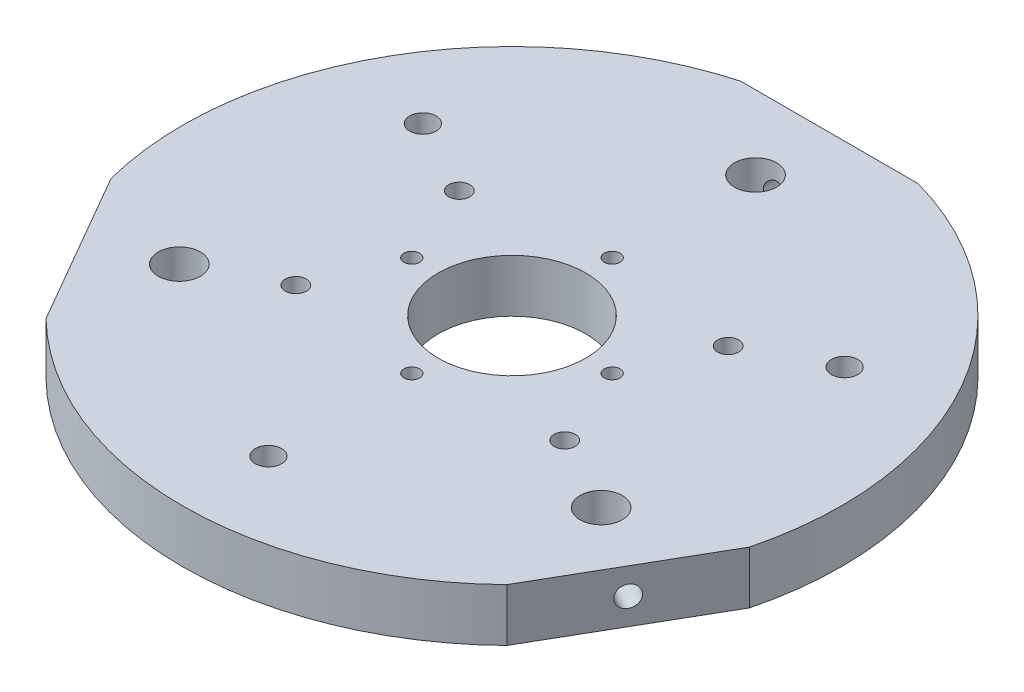
from build123d import *

# Parameters (mm, degrees)
SKETCH1_R           = 62.5
SKETCH1_R_2         = 4
BOSS_EXTRUDE1_DEPTH = 10
SKETCH2_W           = 43.972180284
SKETCH2_H           = 8.711954994
CUT_EXTRUDE1_DEPTH  = 10
SKETCH3_R           = 2
CUT_EXTRUDE2_DEPTH  = 12
SKETCH4_R           = 2
CUT_EXTRUDE3_DEPTH  = 12
SKETCH5_R           = 2
CUT_EXTRUDE4_DEPTH  = 12
SKETCH6_R           = 14
CUT_EXTRUDE5_DEPTH  = 12
SKETCH7_R           = 1.5
CUT_EXTRUDE6_DEPTH  = 10
SKETCH8_R           = 2
CUT_EXTRUDE7_DEPTH  = 10
SKETCH9_R           = 2.5
CUT_EXTRUDE8_DEPTH  = 10


with BuildPart() as part:
    # Sketch1 → Boss-Extrude1 (new body)
    with BuildSketch(Plane(origin=(0, 0, 0), x_dir=(1, 0, 0), z_dir=(0, 1, 0))):
        with Locations(Location((0, 0, 0), (0, 0, 270))):
            Circle(SKETCH1_R)
        with Locations(Location((0, 46.188021535, 0), (0, 0, 270))):
            Circle(SKETCH1_R_2, mode=Mode.SUBTRACT)
        with Locations(Location((40, -23.094010768, 0), (0, 0, 270))):
            Circle(SKETCH1_R_2, mode=Mode.SUBTRACT)
        with Locations(Location((-40, -23.094010768, 0), (0, 0, 270))):
            Circle(SKETCH1_R_2, mode=Mode.SUBTRACT)
    extrude(amount=BOSS_EXTRUDE1_DEPTH)

    # Sketch2 → Cut-Extrude1 (cut)
    with BuildSketch(Plane(origin=(0, 10, 0), x_dir=(1, 0, 0), z_dir=(0, 1, 0))):
        Polygon((-39.581845605, -51.818275424), (-64.713070734, -8.289716646), (-77.687460418, -15.780484023), (-52.55623529, -59.309042801), align=None)
        Polygon((40.609652539, -50.038061596), (63.321086643, -10.700703814), (75.641288558, -17.813775707), (52.929854454, -57.151133488), align=None)
        with Locations((0.471086747, 64.543999032)):
            Rectangle(SKETCH2_W, SKETCH2_H)
    extrude(amount=-CUT_EXTRUDE1_DEPTH, mode=Mode.SUBTRACT)

    # Sketch3 → Cut-Extrude2 (cut)
    with BuildSketch(Plane(origin=(52.124355653, 0, 30.094010768), x_dir=(0.49999999999999983, 0, -0.8660254037844387), z_dir=(0.8660254037844387, 0, 0.49999999999999983))):
        with Locations((0.001973272, 5)):
            Circle(SKETCH3_R)
    extrude(amount=-CUT_EXTRUDE2_DEPTH, mode=Mode.SUBTRACT)

    # Sketch4 → Cut-Extrude3 (cut)
    with BuildSketch(Plane(origin=(-52.124355653, 0, 30.094010768), x_dir=(0.5000000000000002, 0, 0.8660254037844386), z_dir=(-0.8660254037844385, 0, 0.5000000000000001))):
        with Locations((-0.001973272, 5)):
            Circle(SKETCH4_R)
    extrude(amount=-CUT_EXTRUDE3_DEPTH, mode=Mode.SUBTRACT)

    # Sketch5 → Cut-Extrude4 (cut)
    with BuildSketch(Plane(origin=(0, 0, -60.188021535), x_dir=(-1, 0, 0), z_dir=(0, 0, -1))):
        with Locations((-0.001973272, 5)):
            Circle(SKETCH5_R)
    extrude(amount=-CUT_EXTRUDE4_DEPTH, mode=Mode.SUBTRACT)

    # Sketch6 → Cut-Extrude5 (cut)
    with BuildSketch(Plane(origin=(0, 10, 0), x_dir=(1, 0, 0), z_dir=(0, 1, 0))):
        with Locations(Location((0, 0, 0), (0, 0, 270))):
            Circle(SKETCH6_R)
    extrude(amount=-CUT_EXTRUDE5_DEPTH, mode=Mode.SUBTRACT)

    # Sketch7 → Cut-Extrude6 (cut)
    with BuildSketch(Plane(origin=(0, 10, 0), x_dir=(1, 0, 0), z_dir=(0, 1, 0))):
        with Locations(Location((0, 19, 0), (0, 0, 270))):
            Circle(SKETCH7_R)
        with Locations(Location((19, 0, 0), (0, 0, 270))):
            Circle(SKETCH7_R)
        with Locations(Location((0, -19, 0), (0, 0, 270))):
            Circle(SKETCH7_R)
        with Locations(Location((-19, 0, 0), (0, 0, 270))):
            Circle(SKETCH7_R)
    extrude(amount=-CUT_EXTRUDE6_DEPTH, mode=Mode.SUBTRACT)

    # Sketch8 → Cut-Extrude7 (cut)
    with BuildSketch(Plane(origin=(0, 10, 0), x_dir=(1, 0, 0), z_dir=(0, 1, 0))):
        with Locations(Location((-25.5, 15.5, 0), (0, 0, 270))):
            Circle(SKETCH8_R)
        with Locations(Location((25.5, 15.5, 0), (0, 0, 270))):
            Circle(SKETCH8_R)
        with Locations(Location((25.5, -15.5, 0), (0, 0, 270))):
            Circle(SKETCH8_R)
        with Locations(Location((-25.5, -15.5, 0), (0, 0, 270))):
            Circle(SKETCH8_R)
    extrude(amount=-CUT_EXTRUDE7_DEPTH, mode=Mode.SUBTRACT)

    # Sketch9 → Cut-Extrude8 (cut)
    with BuildSketch(Plane(origin=(0, 10, 0), x_dir=(1, 0, 0), z_dir=(0, 1, 0))):
        with Locations(Location((-40, 23.094010768, 0), (0, 0, 270))):
            Circle(SKETCH9_R)
        with Locations(Location((40, 23.094010768, 0), (0, 0, 270))):
            Circle(SKETCH9_R)
        with Locations(Location((0, -46.188021535, 0), (0, 0, 270))):
            Circle(SKETCH9_R)
    extrude(amount=-CUT_EXTRUDE8_DEPTH, mode=Mode.SUBTRACT)


solid = part.part
